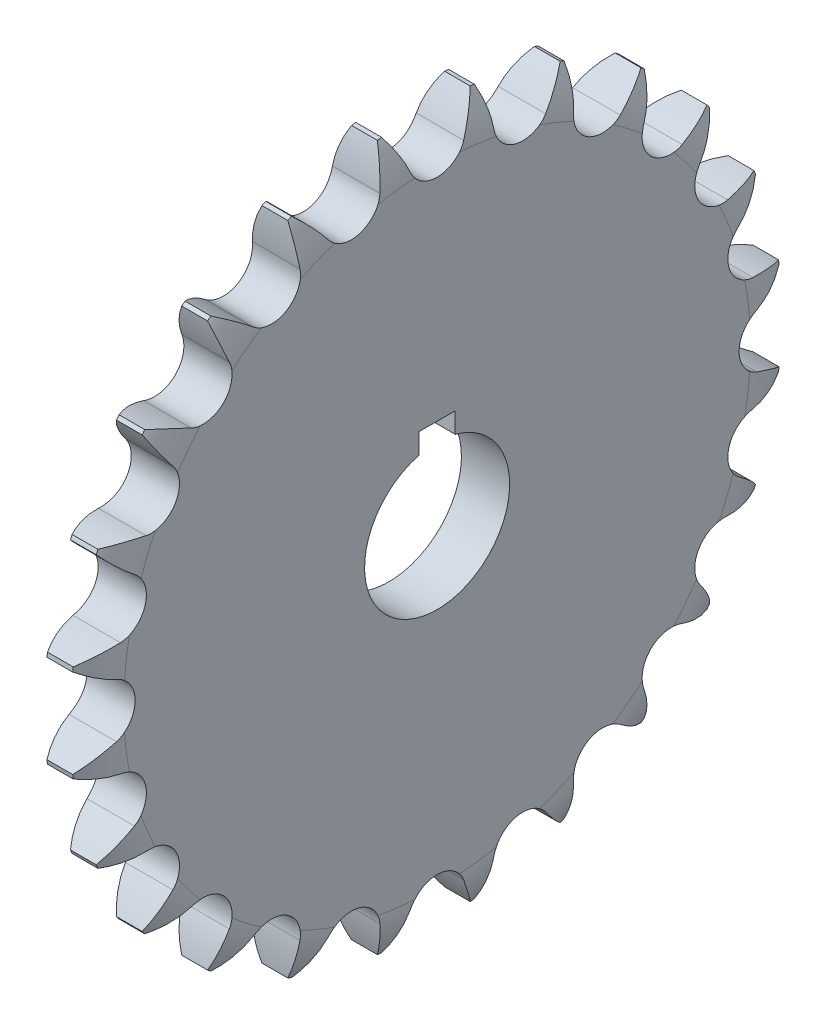
from build123d import *

# Parameters (mm, degrees)
TOOTHCUT_DEPTH      = 56.783395311
TEETHCUTS_COUNT     = 24
TEETHCUTS_ANGLE     = 345
BORSKE_R            = 5
BORE_DEPTH          = 50.0005
SKETCH1_R           = 27
SKETCH1_R_2         = 6
BOSS_EXTRUDE1_DEPTH = 22.6804
SKETCH2_R           = 39.495864355
TRIM_BOSS_DEPTH     = 22.6804
SKETCH3_R           = 8
BORE_CENTRE_DEPTH   = 20
SKETCH4_W           = 4
SKETCH4_H           = 4
CUT_EXTRUDE1_DEPTH  = 10


with BuildPart() as part:
    # BasProSke → Base-Revolve (revolve)
    with BuildSketch(Plane(origin=(0, 0, 0), x_dir=(1, 0, 0), z_dir=(0, 1, 0)), mode=Mode.PRIVATE) as base_revolve_sk:
        with BuildLine():
            Line((0, 0), (0, 34.569178256))
            ThreePointArc((0, 34.569178256), (0.314698702, 36.997341142), (1.238, 39.265054745))
            Line((1.238, 39.265054745), (4.0816, 39.265054745))
            ThreePointArc((4.0816, 39.265054745), (5.004901298, 36.997341142), (5.3196, 34.569178256))
            Line((5.3196, 34.569178256), (5.3196, 0))
            Line((5.3196, 0), (0, 0))
        make_face()
    revolve(base_revolve_sk.sketch.rotate(Axis((-10, 0, 0), (1, 0, 0)), 180), axis=Axis((-10, 0, 0), (1, 0, 0)))

    # TooCutSke → ToothCut (cut, through all)
    with BuildSketch(Plane(origin=(0, 0, 0), x_dir=(0, 0, -1), z_dir=(1, 0, 0))):
        with BuildLine():
            ThreePointArc((2.975860512, 35.323899524), (3.973791538, 37.438985795), (5.214007684, 39.421741498))
            ThreePointArc((5.214007684, 39.421741498), (0, 39.765054745), (-5.214007684, 39.421741498))
            ThreePointArc((-5.214007684, 39.421741498), (-3.973791538, 37.438985795), (-2.975860512, 35.323899524))
            ThreePointArc((-2.975860512, 35.323899524), (0, 33.311929745), (2.975860512, 35.323899524))
        make_face()
    toothcut = extrude(amount=TOOTHCUT_DEPTH, mode=Mode.SUBTRACT)

    # TeethCuts: ToothCut ×24 about axis
    teethcuts_axis = Axis((-10, 0, 0), (1, 0, 0))
    for i in range(1, TEETHCUTS_COUNT):
        add(toothcut.rotate(teethcuts_axis, i * TEETHCUTS_ANGLE / (TEETHCUTS_COUNT - 1)), mode=Mode.SUBTRACT)

    # BorSke → Bore (cut, symmetric)
    with BuildSketch(Plane(origin=(0, 0, 0), x_dir=(0, 0, -1), z_dir=(1, 0, 0))):
        with Locations(Location((0, 0, 0), (0, 0, 180))):
            Circle(BORSKE_R)
    extrude(amount=BORE_DEPTH, both=True, mode=Mode.SUBTRACT)

    # Sketch1 → Boss-Extrude1 (add)
    with BuildSketch(Plane(origin=(5.3196, 0, 0), x_dir=(0, 0, -1), z_dir=(1, 0, 0))):
        with Locations(Location((0, 0, 0), (0, 0, 180))):
            Circle(SKETCH1_R)
        Circle(SKETCH1_R_2, mode=Mode.SUBTRACT)
    extrude(amount=BOSS_EXTRUDE1_DEPTH)

    # Sketch2 → trim boss (cut)
    with BuildSketch(Plane(origin=(28, 0, 0), x_dir=(0, 0, -1), z_dir=(1, 0, 0))):
        Circle(SKETCH2_R)
    extrude(amount=-TRIM_BOSS_DEPTH, mode=Mode.SUBTRACT)

    # Sketch3 → bore centre (cut)
    with BuildSketch(Plane(origin=(5.3196, 0, 0), x_dir=(0, 0, -1), z_dir=(1, 0, 0))):
        Circle(SKETCH3_R)
    extrude(amount=-BORE_CENTRE_DEPTH, mode=Mode.SUBTRACT)

    # Sketch4 → Cut-Extrude1 (cut)
    with BuildSketch(Plane.ZY):
        with Locations((0, 8)):
            Rectangle(SKETCH4_W, SKETCH4_H)
    extrude(amount=-CUT_EXTRUDE1_DEPTH, mode=Mode.SUBTRACT)


solid = part.part
